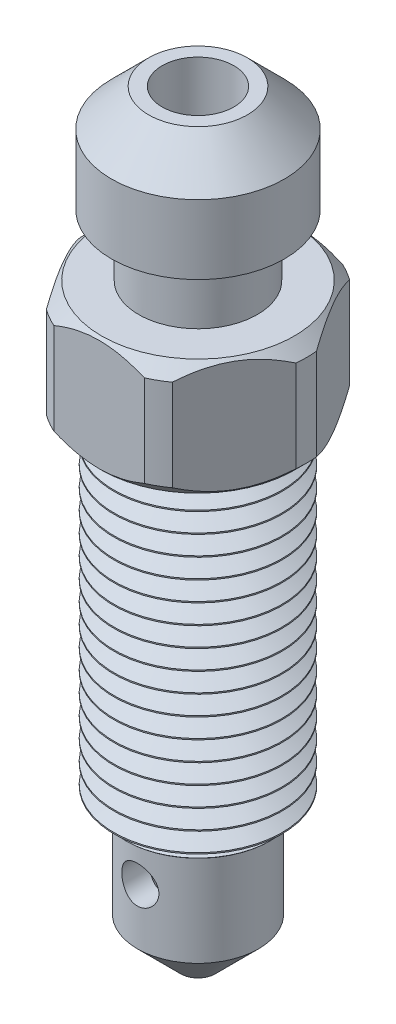
from build123d import *

# Parameters (mm, degrees)
CHAMFER1_SIZE           = 0.5
FILLET1_R               = 0.5
CUT_EXTRUDE1_DEPTH      = 32.373276845
CUT_EXTRUDE1_DEPTH_BACK = 32.373276845
SKETCH2_R               = 0.75
SKETCH3_OUTSIDE_W       = 17.434
SKETCH3_OUTSIDE_H       = 17.434
CUT_EXTRUDE2_DEPTH      = 5
CHAMFER2_SIZE           = 0.5


with BuildPart() as part:
    # Sketch1 → Revolve1 (revolve)
    with BuildSketch(Plane.XY, mode=Mode.PRIVATE) as revolve1_sk:
        Polygon((0, 0), (-0.7, 0), (-2.45, 1.75), (-2.45, 5.75), (-3.4, 5.75), (-3.4, 19.25), (-4.4, 19.25), (-4.4, 23.95), (-2.4, 23.95), (-2.4, 26.45), (-3.5, 26.45), (-3.5, 29.25), (-2, 30.75), (-1.45, 30.75), (-1.45, 2), (0, 2), align=None)
    revolve(revolve1_sk.sketch.rotate(Axis((0, 1.982963205, 0), (0, 1, 0)), 270), axis=Axis((0, 1.982963205, 0), (0, 1, 0)))

    # Chamfer1
    chamfer1_edges = [part.edges().sort_by_distance(p)[0] for p in [
        (0, 23.95, 4.4),
        (0, 19.25, 4.4),
    ]]
    chamfer(chamfer1_edges, length=CHAMFER1_SIZE)

    # Fillet1
    fillet1_edges = [part.edges().sort_by_distance(p)[0] for p in [
        (0, 26.45, 2.4),
    ]]
    fillet(fillet1_edges, radius=FILLET1_R)

    # Sketch2 → Cut-Extrude1 (cut, two sides: drawn at the far end of the back side and taken through both)
    with BuildSketch(Plane.XY.offset(-CUT_EXTRUDE1_DEPTH_BACK)):
        with Locations((0, 4)):
            Circle(SKETCH2_R)
    extrude(amount=CUT_EXTRUDE1_DEPTH + CUT_EXTRUDE1_DEPTH_BACK, mode=Mode.SUBTRACT)

    # Sketch3 outside → Cut-Extrude2 (cut)
    with BuildSketch(Plane(origin=(0, 23.95, 0), x_dir=(1, 0, 0), z_dir=(0, 1, 0))):
        Rectangle(SKETCH3_OUTSIDE_W, SKETCH3_OUTSIDE_H)
        Polygon((4.618802154, 0), (2.309401077, 4), (-2.309401077, 4), (-4.618802154, 0), (-2.309401077, -4), (2.309401077, -4), align=None, mode=Mode.SUBTRACT)
    extrude(amount=-CUT_EXTRUDE2_DEPTH, mode=Mode.SUBTRACT)

    # Chamfer2
    chamfer2_edges = [part.edges().sort_by_distance(p)[0] for p in [
        (0, 5.75, 3.4),
    ]]
    chamfer(chamfer2_edges, length=CHAMFER2_SIZE)

    # Sketch4 → Cut-Revolve1 (revolve, cut)
    with BuildSketch(Plane.XY, mode=Mode.PRIVATE) as cut_revolve1_sk:
        Polygon((3.4, 5.5), (3.4, 6.25), (2.750480947, 5.875), align=None)
        Polygon((3.4, 7.05), (2.750480947, 6.675), (3.4, 6.3), align=None)
        Polygon((3.4, 7.85), (2.750480947, 7.475), (3.4, 7.1), align=None)
        Polygon((3.4, 8.65), (2.750480947, 8.275), (3.4, 7.9), align=None)
        Polygon((3.4, 9.45), (2.750480947, 9.075), (3.4, 8.7), align=None)
        Polygon((3.4, 10.25), (2.750480947, 9.875), (3.4, 9.5), align=None)
        Polygon((3.4, 11.05), (2.750480947, 10.675), (3.4, 10.3), align=None)
        Polygon((3.4, 11.85), (2.750480947, 11.475), (3.4, 11.1), align=None)
        Polygon((3.4, 12.65), (2.750480947, 12.275), (3.4, 11.9), align=None)
        Polygon((3.4, 13.45), (2.750480947, 13.075), (3.4, 12.7), align=None)
        Polygon((3.4, 14.25), (2.750480947, 13.875), (3.4, 13.5), align=None)
        Polygon((3.4, 15.05), (2.750480947, 14.675), (3.4, 14.3), align=None)
        Polygon((3.4, 15.85), (2.750480947, 15.475), (3.4, 15.1), align=None)
        Polygon((3.4, 16.65), (2.750480947, 16.275), (3.4, 15.9), align=None)
        Polygon((3.4, 17.45), (2.750480947, 17.075), (3.4, 16.7), align=None)
        Polygon((3.4, 18.25), (2.750480947, 17.875), (3.4, 17.5), align=None)
        Polygon((3.4, 19.05), (2.750480947, 18.675), (3.4, 18.3), align=None)
    revolve(cut_revolve1_sk.sketch.rotate(Axis((0, 0, 0), (0, 1, 0)), 90), axis=Axis((0, 0, 0), (0, 1, 0)), mode=Mode.SUBTRACT)


solid = part.part
